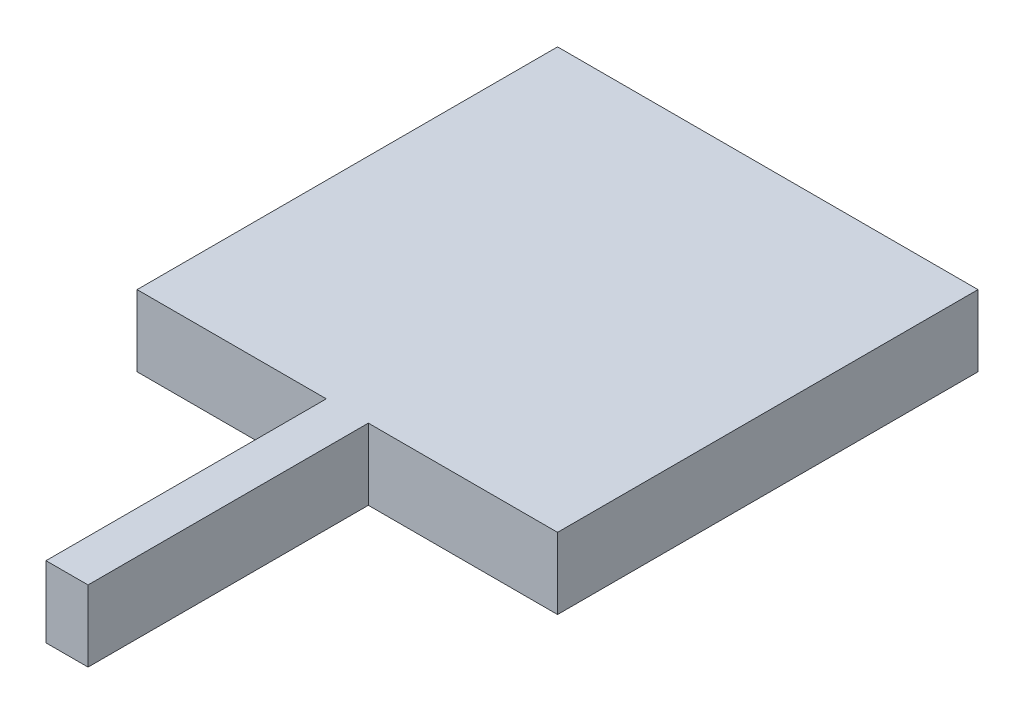
from build123d import *

# Parameters (mm, degrees)
SKETCH1_W           = 3
SKETCH1_H           = 20
BOSS_EXTRUDE1_DEPTH = 5.08


with BuildPart() as part:
    # Sketch1 → Boss-Extrude1 (new body)
    with BuildSketch(Plane(origin=(0, 0, 0), x_dir=(1, 0, 0), z_dir=(0, 1, 0))):
        Polygon((13.5, 0), (16.5, 0), (30, 0), (30, 30), (0, 30), (0, 0), align=None)
        with Locations((15, -10)):
            Rectangle(SKETCH1_W, SKETCH1_H)
    extrude(amount=BOSS_EXTRUDE1_DEPTH)


solid = part.part
